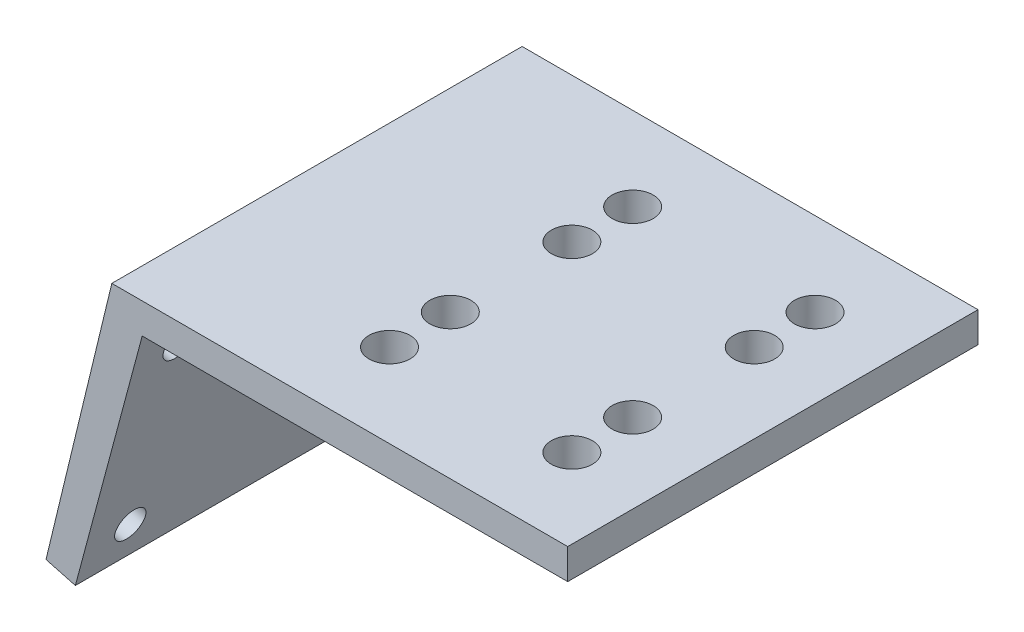
from build123d import *

# Parameters (mm, degrees)
BOSS_EXTRUDE3_DEPTH = 27
SKETCH7_R           = 1.35
CUT_EXTRUDE2_DEPTH  = 20
SKETCH8_R           = 1
CUT_EXTRUDE3_DEPTH  = 20


with BuildPart() as part:
    # Sketch5 → Boss-Extrude3 (new body)
    with BuildSketch(Plane.XY):
        Polygon((0, 0), (-30, 0), (-34.331775419, -17.903100957), (-32.399923767, -18.420739047), (-28, -2), (0, -2), align=None)
    extrude(amount=BOSS_EXTRUDE3_DEPTH)

    # Sketch7 → Cut-Extrude2 (cut)
    with BuildSketch(Plane(origin=(0, 0, 0), x_dir=(1, 0, 0), z_dir=(0, 1, 0))):
        with Locations(Location((-17.22649731, -5.5, 0), (0, 0, 270))):
            Circle(SKETCH7_R)
        with Locations(Location((-17.22649731, -9.5, 0), (0, 0, 270))):
            Circle(SKETCH7_R)
        with Locations(Location((-5.22649731, -5.5, 0), (0, 0, 270))):
            Circle(SKETCH7_R)
        with Locations(Location((-5.22649731, -9.5, 0), (0, 0, 270))):
            Circle(SKETCH7_R)
        with Locations(Location((-5.22649731, -17.5, 0), (0, 0, 180))):
            Circle(SKETCH7_R)
        with Locations(Location((-5.22649731, -21.5, 0), (0, 0, 180))):
            Circle(SKETCH7_R)
        with Locations(Location((-17.22649731, -17.5, 0), (0, 0, 180))):
            Circle(SKETCH7_R)
        with Locations(Location((-17.22649731, -21.5, 0), (0, 0, 180))):
            Circle(SKETCH7_R)
    extrude(amount=-CUT_EXTRUDE2_DEPTH, mode=Mode.SUBTRACT)

    # Sketch8 → Cut-Extrude3 (cut)
    with BuildSketch(Plane(origin=(-28.340840747, 6.857256606, 0), x_dir=(0, 0, 1), z_dir=(-0.9719540583604048, 0.23517080693984682, 0))):
        with Locations(Location((3, -10.855124208, 0), (0, 0, 270))):
            Circle(SKETCH8_R)
        with Locations(Location((3, -23.155124208, 0), (0, 0, 270))):
            Circle(SKETCH8_R)
        with Locations(Location((24, -23.155124208, 0), (0, 0, 270))):
            Circle(SKETCH8_R)
        with Locations(Location((24, -10.855124208, 0), (0, 0, 270))):
            Circle(SKETCH8_R)
    extrude(amount=-CUT_EXTRUDE3_DEPTH, mode=Mode.SUBTRACT)


solid = part.part
